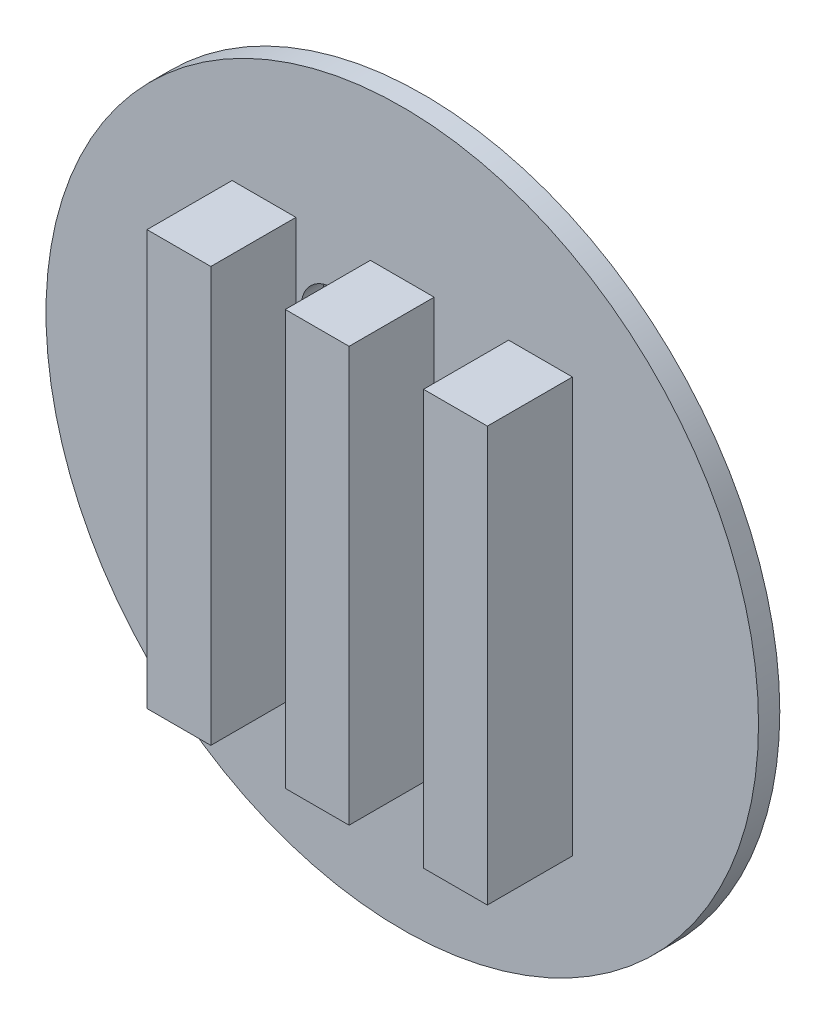
from build123d import *

# Parameters (mm, degrees)
SKETCH1_R          = 16.75
EXTRUDE1_DEPTH     = 1
SKETCH3_W          = 3
SKETCH3_H          = 19.5
EXTRUDE4_DEPTH     = 4
SKETCH4_W          = 2
SKETCH4_H          = 19.5
EXTRUDE5_DEPTH     = 2
SKETCH5_R          = 1.5
CUT_EXTRUDE1_DEPTH = 2


with BuildPart() as part:
    # Sketch1 → Extrude1 (new body)
    with BuildSketch(Plane.XY):
        Circle(SKETCH1_R)
    extrude(amount=EXTRUDE1_DEPTH)

    # Sketch3 → Extrude4 (add)
    with BuildSketch(Plane.XY.offset(1)):
        with Locations((6.5, 0)):
            Rectangle(SKETCH3_W, SKETCH3_H)
        Rectangle(SKETCH3_W, SKETCH3_H)
        with Locations((-6.5, 0)):
            Rectangle(SKETCH3_W, SKETCH3_H)
    extrude(amount=EXTRUDE4_DEPTH)

    # Sketch4 → Extrude5 (add)
    with BuildSketch(Plane.XY):
        with Locations((6.5, 0)):
            Rectangle(SKETCH4_W, SKETCH4_H)
        with Locations((-6.5, 0)):
            Rectangle(SKETCH4_W, SKETCH4_H)
        Rectangle(SKETCH4_W, SKETCH4_H)
    extrude(amount=-EXTRUDE5_DEPTH)

    # Sketch5 → Cut-Extrude1 (cut)
    with BuildSketch(Plane.XY):
        with Locations((-3.25, 6.25)):
            Circle(SKETCH5_R)
        with Locations((3.25, -6.262393856)):
            Circle(SKETCH5_R)
    extrude(amount=CUT_EXTRUDE1_DEPTH, mode=Mode.SUBTRACT)


solid = part.part
